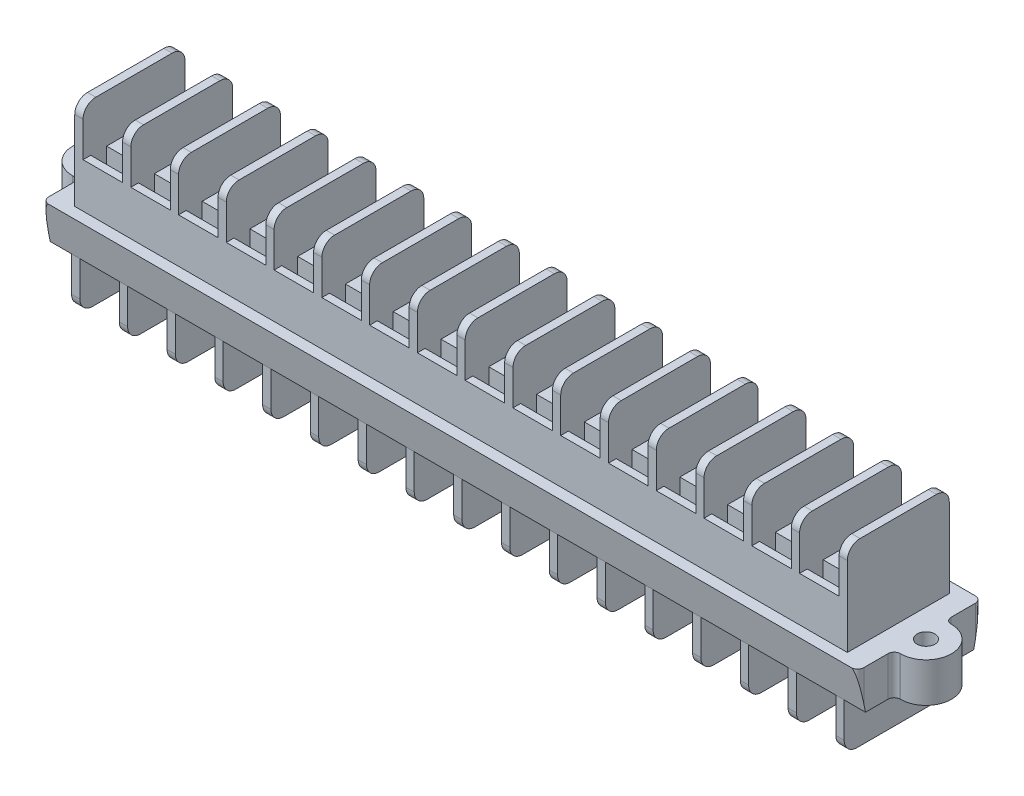
from build123d import *

# Parameters (mm, degrees)
SKETCH_1_W               = 121.3
SKETCH_1_H               = 16
EXTRUDE_1_DEPTH          = 14.5
FILLET_1_R               = 2
SKETCH_2_W               = 6.2
SKETCH_2_H               = 16
CUT_EXTRUDE_1_DEPTH      = 7.5
EXTRUDE_2_DEPTH          = 6.2
SKETCH_4_W               = 121.3
SKETCH_4_H               = 17
EXTRUDE_3_DEPTH          = 7.5
CUT_EXTRUDE_2_DEPTH      = 13
CUT_EXTRUDE_2_DEPTH_BACK = 139
SKETCH_7_R               = 1.4
CUT_EXTRUDE_4_DEPTH      = 72.178033831
SKETCH_8_R               = 3
CUT_EXTRUDE_5_DEPTH      = 3
FILLET_2_R               = 2
SKETCH_6_W               = 6.2
SKETCH_6_H               = 17
CUT_EXTRUDE_3_DEPTH      = 7.5
SKETCH_9_W               = 6.2
SKETCH_9_H               = 2.5
CUT_EXTRUDE_6_DEPTH      = 19.2


with BuildPart() as part:
    # 草图1 → 拉伸1 (new body)
    with BuildSketch(Plane(origin=(0, 0, 0), x_dir=(1, 0, 0), z_dir=(0, 1, 0))):
        Rectangle(SKETCH_1_W, SKETCH_1_H)
    extrude(amount=EXTRUDE_1_DEPTH)

    # 圆角1
    fillet_1_edges = [part.edges().sort_by_distance(p)[0] for p in [
        (0, 14.5, -8),
        (0, 14.5, 8),
    ]]
    fillet(fillet_1_edges, radius=FILLET_1_R)

    # 草图2 → 切除-拉伸1 (cut)
    with BuildSketch(Plane(origin=(0, 14.5, 0), x_dir=(-1, 0, 0), z_dir=(0, 1, 0))):
        with Locations((-56.25, 0)):
            Rectangle(SKETCH_2_W, SKETCH_2_H)
        with Locations((-48.75, 0)):
            Rectangle(SKETCH_2_W, SKETCH_2_H)
        with Locations((-41.25, 0)):
            Rectangle(SKETCH_2_W, SKETCH_2_H)
        with Locations((-33.75, 0)):
            Rectangle(SKETCH_2_W, SKETCH_2_H)
        with Locations((-26.25, 0)):
            Rectangle(SKETCH_2_W, SKETCH_2_H)
        with Locations((-18.75, 0)):
            Rectangle(SKETCH_2_W, SKETCH_2_H)
        with Locations((-11.25, 0)):
            Rectangle(SKETCH_2_W, SKETCH_2_H)
        with Locations((-3.75, 0)):
            Rectangle(SKETCH_2_W, SKETCH_2_H)
        with Locations((3.75, 0)):
            Rectangle(SKETCH_2_W, SKETCH_2_H)
        with Locations((11.25, 0)):
            Rectangle(SKETCH_2_W, SKETCH_2_H)
        with Locations((18.75, 0)):
            Rectangle(SKETCH_2_W, SKETCH_2_H)
        with Locations((26.25, 0)):
            Rectangle(SKETCH_2_W, SKETCH_2_H)
        with Locations((33.75, 0)):
            Rectangle(SKETCH_2_W, SKETCH_2_H)
        with Locations((41.25, 0)):
            Rectangle(SKETCH_2_W, SKETCH_2_H)
        with Locations((48.75, 0)):
            Rectangle(SKETCH_2_W, SKETCH_2_H)
        with Locations((56.25, 0)):
            Rectangle(SKETCH_2_W, SKETCH_2_H)
    extrude(amount=-CUT_EXTRUDE_1_DEPTH, mode=Mode.SUBTRACT)

    # 草图3 → 拉伸2 (add)
    with BuildSketch(Plane.XZ):
        with BuildLine():
            Line((63, 9.75), (-63, 9.75))
            ThreePointArc((-63, 9.75), (-63.707106781, 9.457106781), (-64, 8.75))
            Line((-64, 8.75), (-64, 4.95))
            ThreePointArc((-64, 4.95), (-64.278248558, 4.278248558), (-64.95, 4))
            Line((-64.95, 4), (-65, 4))
            ThreePointArc((-65, 4), (-69, 0), (-65, -4))
            Line((-65, -4), (-64.95, -4))
            ThreePointArc((-64.95, -4), (-64.278248558, -4.278248558), (-64, -4.95))
            Line((-64, -4.95), (-64, -8.75))
            ThreePointArc((-64, -8.75), (-63.707106781, -9.457106781), (-63, -9.75))
            Line((-63, -9.75), (63, -9.75))
            ThreePointArc((63, -9.75), (63.707106781, -9.457106781), (64, -8.75))
            Line((64, -8.75), (64, -4.95))
            ThreePointArc((64, -4.95), (64.278248558, -4.278248558), (64.95, -4))
            Line((64.95, -4), (65, -4))
            ThreePointArc((65, -4), (69, 0), (65, 4))
            Line((65, 4), (64.95, 4))
            ThreePointArc((64.95, 4), (64.278248558, 4.278248558), (64, 4.95))
            Line((64, 4.95), (64, 8.75))
            ThreePointArc((64, 8.75), (63.707106781, 9.457106781), (63, 9.75))
        make_face()
    extrude(amount=EXTRUDE_2_DEPTH)

    # 草图4 → 拉伸3 (add)
    with BuildSketch(Plane.XZ.offset(6.2)):
        Rectangle(SKETCH_4_W, SKETCH_4_H)
    extrude(amount=EXTRUDE_3_DEPTH)

    # 草图5 → 切除-拉伸2 (cut, two sides: drawn at the far end of the back side and taken through both)
    with BuildSketch(Plane.ZY.offset(60.65).offset(-CUT_EXTRUDE_2_DEPTH_BACK)):
        Polygon((-8.5, -6.2), (-9.75, 0), (-9.75, -6.2), align=None)
        Polygon((8.5, -6.2), (9.75, -6.2), (9.75, 0), align=None)
    extrude(amount=CUT_EXTRUDE_2_DEPTH + CUT_EXTRUDE_2_DEPTH_BACK, mode=Mode.SUBTRACT)

    # 草图7 → 切除-拉伸4 (cut, through all)
    with BuildSketch(Plane(origin=(0, 0, 0), x_dir=(-1, 0, 0), z_dir=(0, 1, 0))):
        with Locations(Location((-65, 0, 0), (0, 0, 90))):
            Circle(SKETCH_7_R)
        with Locations(Location((65, 0, 0), (0, 0, 90))):
            Circle(SKETCH_7_R)
    extrude(amount=-CUT_EXTRUDE_4_DEPTH, mode=Mode.SUBTRACT)

    # 草图8 → 切除-拉伸5 (cut)
    with BuildSketch(Plane(origin=(0, -6.2, 0), x_dir=(-1, 0, 0), z_dir=(0, 1, 0))):
        with Locations(Location((65, 0, 0), (0, 0, 90))):
            Circle(SKETCH_8_R)
        with Locations(Location((-65, 0, 0), (0, 0, 90))):
            Circle(SKETCH_8_R)
    extrude(amount=CUT_EXTRUDE_5_DEPTH, mode=Mode.SUBTRACT)

    # 圆角2
    fillet_2_edges = [part.edges().sort_by_distance(p)[0] for p in [
        (0, -13.7, -8.5),
        (0, -13.7, 8.5),
    ]]
    fillet(fillet_2_edges, radius=FILLET_2_R)

    # 草图6 → 切除-拉伸3 (cut)
    with BuildSketch(Plane.XZ.offset(13.7)):
        with Locations((56.25, 0)):
            Rectangle(SKETCH_6_W, SKETCH_6_H)
        with Locations((48.75, 0)):
            Rectangle(SKETCH_6_W, SKETCH_6_H)
        with Locations((41.25, 0)):
            Rectangle(SKETCH_6_W, SKETCH_6_H)
        with Locations((33.75, 0)):
            Rectangle(SKETCH_6_W, SKETCH_6_H)
        with Locations((26.25, 0)):
            Rectangle(SKETCH_6_W, SKETCH_6_H)
        with Locations((18.75, 0)):
            Rectangle(SKETCH_6_W, SKETCH_6_H)
        with Locations((11.25, 0)):
            Rectangle(SKETCH_6_W, SKETCH_6_H)
        with Locations((3.75, 0)):
            Rectangle(SKETCH_6_W, SKETCH_6_H)
        with Locations((-3.75, 0)):
            Rectangle(SKETCH_6_W, SKETCH_6_H)
        with Locations((-11.25, 0)):
            Rectangle(SKETCH_6_W, SKETCH_6_H)
        with Locations((-18.75, 0)):
            Rectangle(SKETCH_6_W, SKETCH_6_H)
        with Locations((-26.25, 0)):
            Rectangle(SKETCH_6_W, SKETCH_6_H)
        with Locations((-33.75, 0)):
            Rectangle(SKETCH_6_W, SKETCH_6_H)
        with Locations((-41.25, 0)):
            Rectangle(SKETCH_6_W, SKETCH_6_H)
        with Locations((-48.75, 0)):
            Rectangle(SKETCH_6_W, SKETCH_6_H)
        with Locations((-56.25, 0)):
            Rectangle(SKETCH_6_W, SKETCH_6_H)
    extrude(amount=-CUT_EXTRUDE_3_DEPTH, mode=Mode.SUBTRACT)

    # 草图9 → 切除-拉伸6 (cut)
    with BuildSketch(Plane(origin=(0, 14.5, 0), x_dir=(-1, 0, 0), z_dir=(0, 1, 0))):
        with Locations((56.25, -5.55)):
            Rectangle(SKETCH_9_W, SKETCH_9_H)
        with Locations((48.75, -5.55)):
            Rectangle(SKETCH_9_W, SKETCH_9_H)
        with Locations((56.25, 5.55)):
            Rectangle(SKETCH_9_W, SKETCH_9_H)
        with Locations((48.75, 5.55)):
            Rectangle(SKETCH_9_W, SKETCH_9_H)
        with Locations((41.25, -5.55)):
            Rectangle(SKETCH_9_W, SKETCH_9_H)
        with Locations((41.25, 5.55)):
            Rectangle(SKETCH_9_W, SKETCH_9_H)
        with Locations((33.75, -5.55)):
            Rectangle(SKETCH_9_W, SKETCH_9_H)
        with Locations((33.75, 5.55)):
            Rectangle(SKETCH_9_W, SKETCH_9_H)
        with Locations((26.25, -5.55)):
            Rectangle(SKETCH_9_W, SKETCH_9_H)
        with Locations((26.25, 5.55)):
            Rectangle(SKETCH_9_W, SKETCH_9_H)
        with Locations((18.75, -5.55)):
            Rectangle(SKETCH_9_W, SKETCH_9_H)
        with Locations((18.75, 5.55)):
            Rectangle(SKETCH_9_W, SKETCH_9_H)
        with Locations((11.25, -5.55)):
            Rectangle(SKETCH_9_W, SKETCH_9_H)
        with Locations((11.25, 5.55)):
            Rectangle(SKETCH_9_W, SKETCH_9_H)
        with Locations((3.75, -5.55)):
            Rectangle(SKETCH_9_W, SKETCH_9_H)
        with Locations((3.75, 5.55)):
            Rectangle(SKETCH_9_W, SKETCH_9_H)
        with Locations((-3.75, -5.55)):
            Rectangle(SKETCH_9_W, SKETCH_9_H)
        with Locations((-3.75, 5.55)):
            Rectangle(SKETCH_9_W, SKETCH_9_H)
        with Locations((-11.25, -5.55)):
            Rectangle(SKETCH_9_W, SKETCH_9_H)
        with Locations((-11.25, 5.55)):
            Rectangle(SKETCH_9_W, SKETCH_9_H)
        with Locations((-18.75, -5.55)):
            Rectangle(SKETCH_9_W, SKETCH_9_H)
        with Locations((-18.75, 5.55)):
            Rectangle(SKETCH_9_W, SKETCH_9_H)
        with Locations((-26.25, -5.55)):
            Rectangle(SKETCH_9_W, SKETCH_9_H)
        with Locations((-26.25, 5.55)):
            Rectangle(SKETCH_9_W, SKETCH_9_H)
        with Locations((-33.75, -5.55)):
            Rectangle(SKETCH_9_W, SKETCH_9_H)
        with Locations((-33.75, 5.55)):
            Rectangle(SKETCH_9_W, SKETCH_9_H)
        with Locations((-41.25, -5.55)):
            Rectangle(SKETCH_9_W, SKETCH_9_H)
        with Locations((-41.25, 5.55)):
            Rectangle(SKETCH_9_W, SKETCH_9_H)
        with Locations((-48.75, -5.55)):
            Rectangle(SKETCH_9_W, SKETCH_9_H)
        with Locations((-48.75, 5.55)):
            Rectangle(SKETCH_9_W, SKETCH_9_H)
        with Locations((-56.25, -5.55)):
            Rectangle(SKETCH_9_W, SKETCH_9_H)
        with Locations((-56.25, 5.55)):
            Rectangle(SKETCH_9_W, SKETCH_9_H)
    extrude(amount=-CUT_EXTRUDE_6_DEPTH, mode=Mode.SUBTRACT)


solid = part.part
